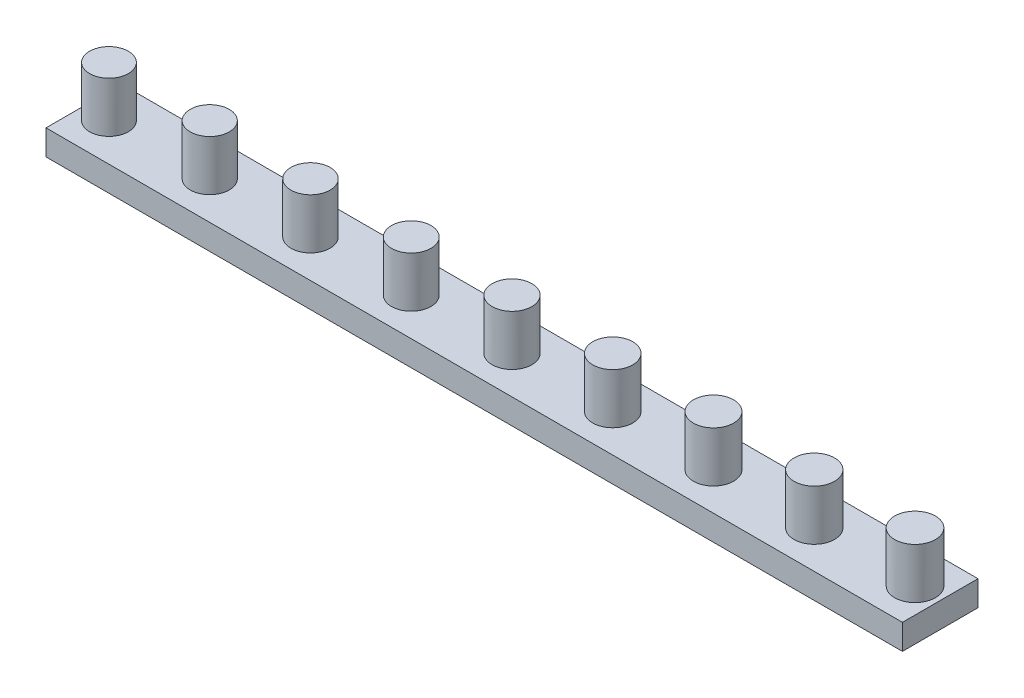
from build123d import *

# Parameters (mm, degrees)
SKETCH_3_W      = 170
SKETCH_3_H      = 15
EXTRUDE_3_DEPTH = 5
SKETCH_4_R      = 3.85
SKETCH_4_R_2    = 3.875
SKETCH_4_R_3    = 3.9
SKETCH_4_R_4    = 3.925
SKETCH_4_R_5    = 3.95
SKETCH_4_R_6    = 3.975
SKETCH_4_R_7    = 4
SKETCH_4_R_8    = 4.025
SKETCH_4_R_9    = 4.05
EXTRUDE_4_DEPTH = 10


with BuildPart() as part:
    # 스케치3 → 보스-돌출3 (new body)
    with BuildSketch(Plane(origin=(0, 0, 0), x_dir=(1, 0, 0), z_dir=(0, 1, 0))):
        Rectangle(SKETCH_3_W, SKETCH_3_H)
    extrude(amount=EXTRUDE_3_DEPTH)

    # 스케치4 → 보스-돌출4 (add)
    with BuildSketch(Plane(origin=(0, 5, 0), x_dir=(1, 0, 0), z_dir=(0, 1, 0))):
        with Locations(Location((-80, 0, 0), (0, 0, 90))):
            Circle(SKETCH_4_R)
        with Locations(Location((-60, 0, 0), (0, 0, 90))):
            Circle(SKETCH_4_R_2)
        with Locations(Location((-40, 0, 0), (0, 0, 90))):
            Circle(SKETCH_4_R_3)
        with Locations(Location((-20, 0, 0), (0, 0, 90))):
            Circle(SKETCH_4_R_4)
        with Locations(Location((0, 0, 0), (0, 0, 90))):
            Circle(SKETCH_4_R_5)
        with Locations(Location((20, 0, 0), (0, 0, 90))):
            Circle(SKETCH_4_R_6)
        with Locations(Location((40, 0, 0), (0, 0, 90))):
            Circle(SKETCH_4_R_7)
        with Locations(Location((60, 0, 0), (0, 0, 90))):
            Circle(SKETCH_4_R_8)
        with Locations(Location((80, 0, 0), (0, 0, 90))):
            Circle(SKETCH_4_R_9)
    extrude(amount=EXTRUDE_4_DEPTH)


solid = part.part
